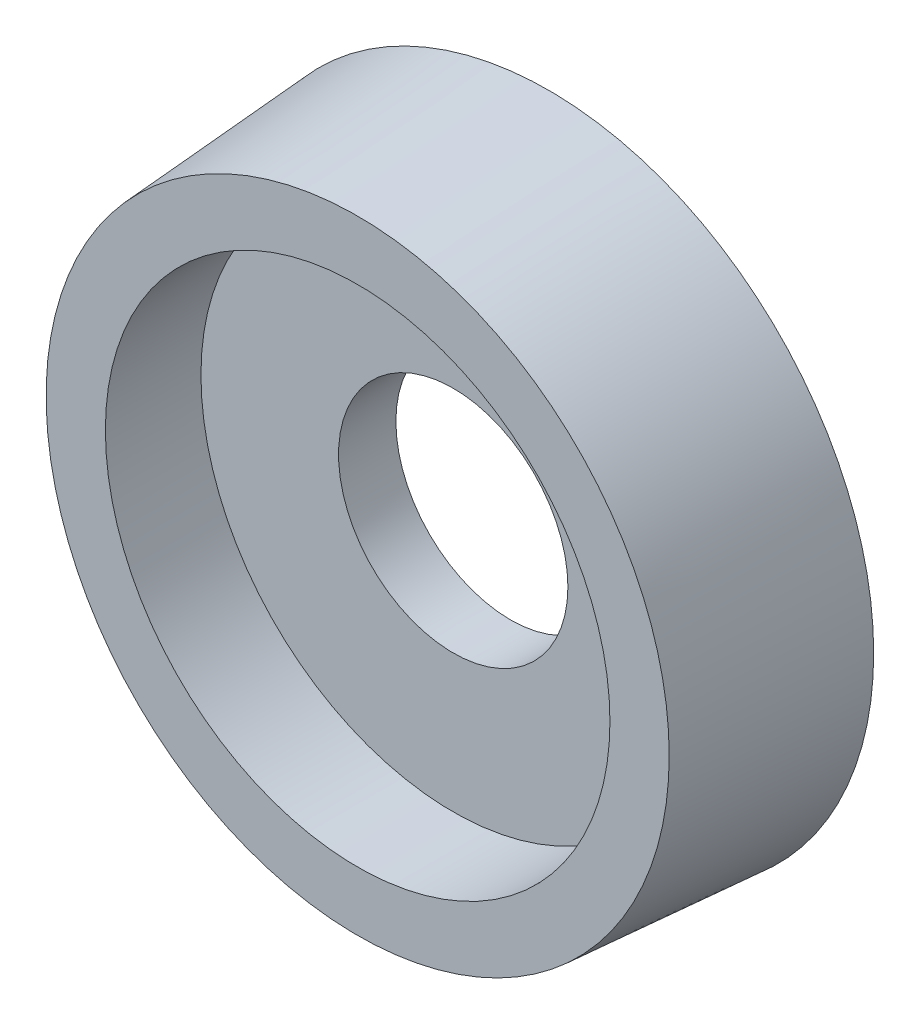
from build123d import *

# Parameters (mm, degrees)
SKETCH_1_R               = 8.5
EXTRUDE_1_DEPTH          = 5
EXTRUDE_1_TAPER          = 4
SKETCH_3_R               = 5
CUT_EXTRUDE_1_DEPTH      = 1
SKETCH_4_R               = 6.6
CUT_EXTRUDE_2_DEPTH      = 2.5
CUT_EXTRUDE_3_DEPTH      = 13.278029158
CUT_EXTRUDE_3_DEPTH_BACK = 13.278029158
SKETCH_5_R               = 3


with BuildPart() as part:
    # Эскиз1 → Бобышка-Вытянуть1 (new body)
    with BuildSketch(Plane.XY):
        Circle(SKETCH_1_R)
    extrude(amount=EXTRUDE_1_DEPTH, taper=EXTRUDE_1_TAPER)

    # Эскиз3 → Вырез-Вытянуть1 (cut)
    with BuildSketch(Plane(origin=(0, 0, 0), x_dir=(-1, 0, 0), z_dir=(0, 0, -1))):
        Circle(SKETCH_3_R)
    extrude(amount=-CUT_EXTRUDE_1_DEPTH, mode=Mode.SUBTRACT)

    # Эскиз4 → Вырез-Вытянуть2 (cut)
    with BuildSketch(Plane.XY.offset(5)):
        Circle(SKETCH_4_R)
    extrude(amount=-CUT_EXTRUDE_2_DEPTH, mode=Mode.SUBTRACT)

    # Эскиз5 → Вырез-Вытянуть3 (cut, two sides: drawn at the far end of the back side and taken through both)
    with BuildSketch(Plane.XY.offset(2.5).offset(-CUT_EXTRUDE_3_DEPTH_BACK)):
        Circle(SKETCH_5_R)
    extrude(amount=CUT_EXTRUDE_3_DEPTH + CUT_EXTRUDE_3_DEPTH_BACK, mode=Mode.SUBTRACT)


solid = part.part
